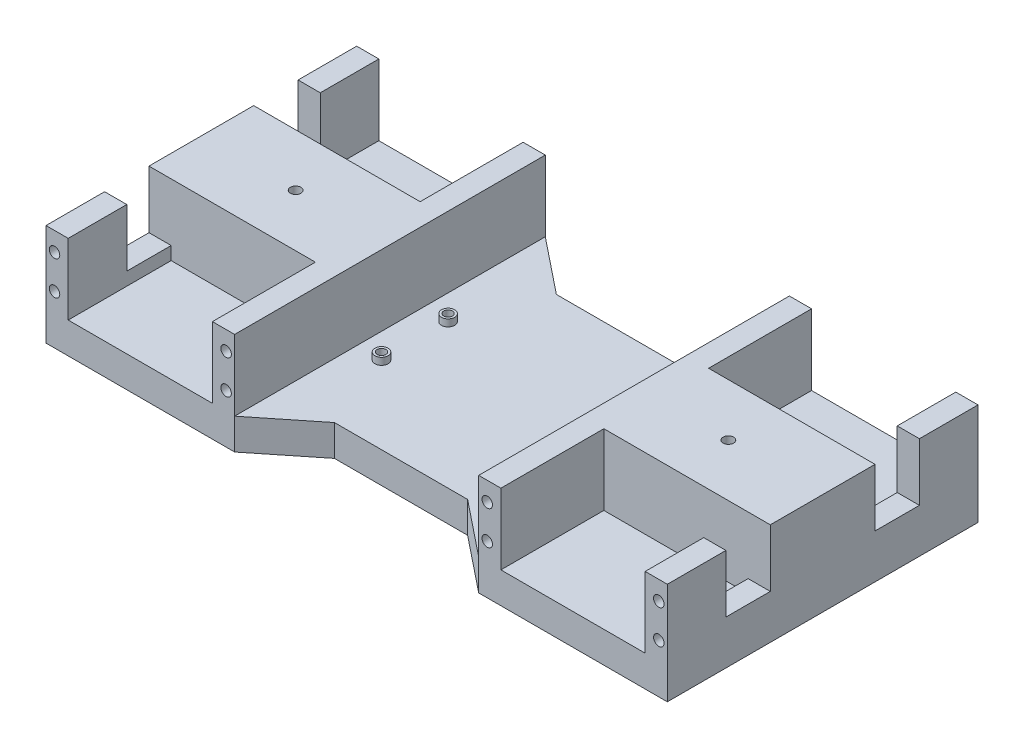
from build123d import *

# Parameters (mm, degrees)
SKETCH2_W           = 41.275
SKETCH2_H           = 29.464
BOSS_EXTRUDE1_DEPTH = 8.89
BOSS_EXTRUDE2_DEPTH = 29.14396
SKETCH6_R           = 1.5
CUT_EXTRUDE1_DEPTH  = 6.5
SKETCH7_R           = 1.5
CUT_EXTRUDE2_DEPTH  = 6
SKETCH8_R           = 1.885
SKETCH8_R_2         = 1.25
EXTRUDE_THIN1_DEPTH = 2
CUT_EXTRUDE3_START  = -21.78
SKETCH8_3_R         = 1.25
CUT_EXTRUDE3_DEPTH  = 21.78
CUT_EXTRUDE4_START  = -82.9
SKETCH7_2_R         = 1.5
CUT_EXTRUDE4_DEPTH  = 6
SKETCH9_W           = 12.7
SKETCH9_H           = 16.51
CUT_EXTRUDE5_DEPTH  = 6.35
CUT_EXTRUDE6_START  = -177.8
SKETCH9_2_W         = 12.7
SKETCH9_2_H         = 16.51
CUT_EXTRUDE6_DEPTH  = 6.35
SKETCH10_R          = 1
CUT_EXTRUDE8_DEPTH  = 2


with BuildPart() as part:
    # Sketch2 → Boss-Extrude1 (new body)
    with BuildSketch(Plane(origin=(0, 0, 0), x_dir=(1, 0, 0), z_dir=(0, 1, 0))):
        with Locations((26.9875, 74.168)):
            Rectangle(SKETCH2_W, SKETCH2_H)
        with Locations((26.9875, 14.732)):
            Rectangle(SKETCH2_W, SKETCH2_H)
        Polygon((0, 88.9), (0, 0), (6.35, 0), (6.35, 29.464), (47.625, 29.464), (47.625, 0), (53.975, 0), (53.975, 12.7), (53.975, 76.2), (53.975, 88.9), (47.625, 88.9), (47.625, 59.436), (6.35, 59.436), (6.35, 88.9), align=None)
        Polygon((53.975, 12.7), (69.85, 12.7), (107.95, 12.7), (123.825, 12.7), (123.825, 76.2), (107.95, 76.2), (69.85, 76.2), (53.975, 76.2), align=None)
        Polygon((53.975, 12.7), (53.975, 0), (69.85, 12.7), align=None)
        Polygon((107.95, 12.7), (123.825, 0), (123.825, 12.7), align=None)
        Polygon((123.825, 12.7), (123.825, 0), (130.175, 0), (130.175, 29.464), (171.45, 29.464), (171.45, 0), (177.8, 0), (177.8, 88.9), (171.45, 88.9), (171.45, 59.436), (130.175, 59.436), (130.175, 88.9), (123.825, 88.9), (123.825, 76.2), align=None)
        with Locations((150.8125, 14.732)):
            Rectangle(SKETCH2_W, SKETCH2_H)
        with Locations((150.8125, 74.168)):
            Rectangle(SKETCH2_W, SKETCH2_H)
        Polygon((123.825, 76.2), (123.825, 88.9), (107.95, 76.2), align=None)
        Polygon((69.85, 76.2), (53.975, 88.9), (53.975, 76.2), align=None)
    extrude(amount=BOSS_EXTRUDE1_DEPTH)

    # Sketch2<3> → Boss-Extrude2 (add)
    with BuildSketch(Plane(origin=(0, 0, 0), x_dir=(1, 0, 0), z_dir=(0, 1, 0))):
        Polygon((0, 88.9), (0, 0), (6.35, 0), (6.35, 29.464), (47.625, 29.464), (47.625, 0), (53.975, 0), (53.975, 12.7), (53.975, 76.2), (53.975, 88.9), (47.625, 88.9), (47.625, 59.436), (6.35, 59.436), (6.35, 88.9), align=None)
        Polygon((123.825, 12.7), (123.825, 0), (130.175, 0), (130.175, 29.464), (171.45, 29.464), (171.45, 0), (177.8, 0), (177.8, 88.9), (171.45, 88.9), (171.45, 59.436), (130.175, 59.436), (130.175, 88.9), (123.825, 88.9), (123.825, 76.2), align=None)
    extrude(amount=BOSS_EXTRUDE2_DEPTH)

    # Sketch6 → Cut-Extrude1 (cut)
    with BuildSketch(Plane(origin=(0, 29.14396, 0), x_dir=(1, 0, 0), z_dir=(0, 1, 0))):
        with Locations(Location((26.9875, 44.45, 0), (0, 0, 270))):
            Circle(SKETCH6_R)
        with Locations(Location((150.8125, 44.45, 0), (0, 0, 270))):
            Circle(SKETCH6_R)
    extrude(amount=-CUT_EXTRUDE1_DEPTH, mode=Mode.SUBTRACT)

    # Sketch7 → Cut-Extrude2 (cut)
    with BuildSketch(Plane.XY):
        with Locations((2.4375, 14.04)):
            Circle(SKETCH7_R)
        with Locations((51.5375, 14.04)):
            Circle(SKETCH7_R)
        with Locations((2.4375, 23.740006)):
            Circle(SKETCH7_R)
        with Locations((51.5375, 23.740006)):
            Circle(SKETCH7_R)
        with Locations(Location((126.2625, 23.740006, 0), (0, 0, 180))):
            Circle(SKETCH7_R)
        with Locations(Location((175.3625, 23.740006, 0), (0, 0, 180))):
            Circle(SKETCH7_R)
        with Locations(Location((126.2625, 14.04, 0), (0, 0, 180))):
            Circle(SKETCH7_R)
        with Locations(Location((175.3625, 14.04, 0), (0, 0, 180))):
            Circle(SKETCH7_R)
    extrude(amount=-CUT_EXTRUDE2_DEPTH, mode=Mode.SUBTRACT)

    # Sketch8 → Extrude-Thin1 (add)
    # profile 1 of 4: a face of its own
    with BuildSketch(Plane(origin=(0, 8.89, 0), x_dir=(1, 0, 0), z_dir=(0, 1, 0))):
        with Locations((61.087, 53.975)):
            Circle(SKETCH8_R)
        with Locations((61.087, 53.975)):
            Circle(SKETCH8_R_2, mode=Mode.SUBTRACT)
    # profile 2 of 4: a face of its own
    with BuildSketch(Plane(origin=(0, 8.89, 0), x_dir=(1, 0, 0), z_dir=(0, 1, 0))):
        with Locations((61.087, 34.925)):
            Circle(SKETCH8_R)
        with Locations((61.087, 34.925)):
            Circle(SKETCH8_R_2, mode=Mode.SUBTRACT)
    # profile 3 of 4: a face of its own
    with BuildSketch(Plane(origin=(0, 8.89, 0), x_dir=(1, 0, 0), z_dir=(0, 1, 0))):
        with Locations((116.713, 34.925)):
            Circle(SKETCH8_R)
        with Locations((116.713, 34.925)):
            Circle(SKETCH8_R_2, mode=Mode.SUBTRACT)
    # profile 4 of 4: a face of its own
    with BuildSketch(Plane(origin=(0, 8.89, 0), x_dir=(1, 0, 0), z_dir=(0, 1, 0))):
        with Locations((116.713, 53.975)):
            Circle(SKETCH8_R)
        with Locations((116.713, 53.975)):
            Circle(SKETCH8_R_2, mode=Mode.SUBTRACT)
    extrude(amount=EXTRUDE_THIN1_DEPTH)

    # Sketch8<3> → Cut-Extrude3 (cut)
    with BuildSketch(Plane(origin=(0, 8.89, 0), x_dir=(1, 0, 0), z_dir=(0, 1, 0)).offset(CUT_EXTRUDE3_START)):
        with Locations(Location((61.087, 53.975, 0), (0, 0, 270))):
            Circle(SKETCH8_3_R)
        with Locations(Location((61.087, 34.925, 0), (0, 0, 270))):
            Circle(SKETCH8_3_R)
        with Locations(Location((116.713, 34.925, 0), (0, 0, 270))):
            Circle(SKETCH8_3_R)
        with Locations(Location((116.713, 53.975, 0), (0, 0, 270))):
            Circle(SKETCH8_3_R)
    extrude(amount=CUT_EXTRUDE3_DEPTH, mode=Mode.SUBTRACT)

    # Sketch7<2> → Cut-Extrude4 (cut)
    with BuildSketch(Plane.XY.offset(CUT_EXTRUDE4_START)):
        with Locations((2.4375, 14.04)):
            Circle(SKETCH7_2_R)
        with Locations((51.5375, 14.04)):
            Circle(SKETCH7_2_R)
        with Locations((2.4375, 23.740006)):
            Circle(SKETCH7_2_R)
        with Locations((51.5375, 23.740006)):
            Circle(SKETCH7_2_R)
        with Locations(Location((126.2625, 23.740006, 0), (0, 0, 180))):
            Circle(SKETCH7_2_R)
        with Locations(Location((175.3625, 23.740006, 0), (0, 0, 180))):
            Circle(SKETCH7_2_R)
        with Locations(Location((126.2625, 14.04, 0), (0, 0, 180))):
            Circle(SKETCH7_2_R)
        with Locations(Location((175.3625, 14.04, 0), (0, 0, 180))):
            Circle(SKETCH7_2_R)
    extrude(amount=-CUT_EXTRUDE4_DEPTH, mode=Mode.SUBTRACT)

    # Sketch9 → Cut-Extrude5 (cut)
    with BuildSketch(Plane.ZY):
        with Locations((-23.114, 20.88896)):
            Rectangle(SKETCH9_W, SKETCH9_H)
        with Locations((-65.786, 20.88896)):
            Rectangle(SKETCH9_W, SKETCH9_H)
    extrude(amount=-CUT_EXTRUDE5_DEPTH, mode=Mode.SUBTRACT)

    # Sketch9<2> → Cut-Extrude6 (cut)
    with BuildSketch(Plane.ZY.offset(CUT_EXTRUDE6_START)):
        with Locations((-23.114, 20.88896)):
            Rectangle(SKETCH9_2_W, SKETCH9_2_H)
        with Locations((-65.786, 20.88896)):
            Rectangle(SKETCH9_2_W, SKETCH9_2_H)
    extrude(amount=CUT_EXTRUDE6_DEPTH, mode=Mode.SUBTRACT)

    # Sketch10 → Cut-Extrude8 (cut)
    with BuildSketch(Plane.ZY):
        with Locations((-54.991, 25.46096)):
            Circle(SKETCH10_R)
        with Locations((-33.909, 25.46096)):
            Circle(SKETCH10_R)
        with Locations((-33.909, 15.80896)):
            Circle(SKETCH10_R)
        with Locations((-54.991, 15.80896)):
            Circle(SKETCH10_R)
    extrude(amount=-CUT_EXTRUDE8_DEPTH, mode=Mode.SUBTRACT)


solid = part.part
